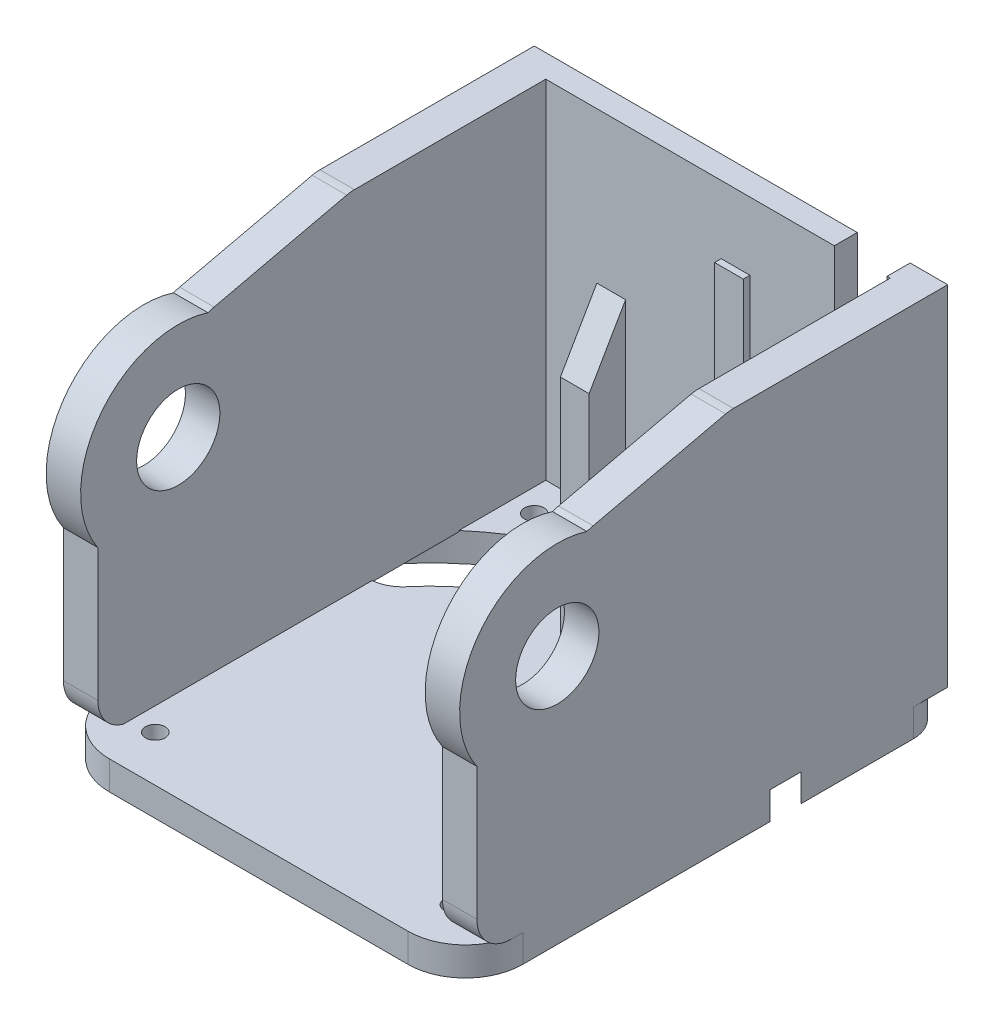
from build123d import *

# Parameters (mm, degrees)
BASE_START                                   = 59
BASE_PLATE_DEPTH                             = 5
BOLT_START                                   = 58.8
SKETCH2_R                                    = 1.7
BOLT_HOLES_CABLE_KIDNEY_DEPTH                = 5.4
CHEEK_START                                  = -36
CHEEK_X_DEPTH                                = 6
PIVOT_START                                  = -36
SKETCH4_R                                    = 17
PIVOT_BOSS_X_DEPTH                           = 6
CHEEK_START_2                                = 30
CHEEK_X_2_DEPTH                              = 6
PIVOT_START_2                                = 30
SKETCH6_R                                    = 17
PIVOT_BOSS_X_2_DEPTH                         = 6
JOURNAL_START                                = -37
SKETCH7_R                                    = 7.25
JOURNAL_BORES_DEPTH                          = 74
BACK_START                                   = -54
SKETCH8_W                                    = 72
SKETCH8_H                                    = 60.7
BACK_WALL_DEPTH                              = 4
PINION_START                                 = -55
SKETCH9_W                                    = 9.2
SKETCH9_H                                    = 45
PINION_NOTCH_DEPTH                           = 6
SERVO_START                                  = 0.55
SKETCH10_W                                   = 28.2
SKETCH10_H                                   = 58.7
SKETCH10_W_2                                 = 20.5
SKETCH10_H_2                                 = 41.5
SERVO_BULKHEAD_DEPTH                         = 5
TAB_START                                    = 0.35
SKETCH11_R                                   = 1.7
TAB_BOLT_HOLES_DEPTH                         = 5.4
TAB_START_2                                  = 2.85
TAB_NUT_POCKETS_DEPTH                        = 2.9
BULKHEAD_START                               = 0.35
BULKHEAD_CHAMFER_DEPTH                       = 5.4
HAND_START                                   = 0.35
SKETCH14_W                                   = 21.65
SKETCH14_H                                   = 13.8
HAND_FIX_BAR_OVER_THE_SERVO_WINDOW_SAW_DEPTH = 5.4


with BuildPart() as part:
    # Sketch1 → Base plate (new body)
    with BuildSketch(Plane(origin=(0, 0, 0), x_dir=(1, 0, 0), z_dir=(0, 1, 0)).offset(BASE_START)):
        with BuildLine():
            Line((-30, 54), (30, 54))
            ThreePointArc((30, 54), (34.242640687, 52.242640687), (36, 48))
            Line((36, 48), (36, -20))
            ThreePointArc((36, -20), (33.071067812, -27.071067812), (26, -30))
            Line((26, -30), (-26, -30))
            ThreePointArc((-26, -30), (-33.071067812, -27.071067812), (-36, -20))
            Line((-36, -20), (-36, 48))
            ThreePointArc((-36, 48), (-34.242640687, 52.242640687), (-30, 54))
        make_face()
    extrude(amount=BASE_PLATE_DEPTH)

    # Sketch2 → Bolt holes + cable kidney (cut)
    with BuildSketch(Plane(origin=(0, 0, 0), x_dir=(1, 0, 0), z_dir=(0, 1, 0)).offset(BOLT_START)):
        with Locations((-26, 44)):
            Circle(SKETCH2_R)
        with Locations((-26, -22)):
            Circle(SKETCH2_R)
        with Locations((26, 44)):
            Circle(SKETCH2_R)
        with Locations((26, -22)):
            Circle(SKETCH2_R)
        with BuildLine():
            ThreePointArc((-35.238044383, 29.568230046), (0, 46), (35.238044383, 29.568230046))
            ThreePointArc((35.238044383, 29.568230046), (34.498503383, 21.115237729), (26.045511066, 21.854778729))
            ThreePointArc((26.045511066, 21.854778729), (0, 34), (-26.045511066, 21.854778729))
            ThreePointArc((-26.045511066, 21.854778729), (-34.498503383, 21.115237729), (-35.238044383, 29.568230046))
        make_face()
    extrude(amount=BOLT_HOLES_CABLE_KIDNEY_DEPTH, mode=Mode.SUBTRACT)


with BuildPart() as bolt_holes_cable_kidney_piece_1:
    # of the separate pieces the step leaves, piece 1, a body of its own (bolt_holes_cable_kidney_pieces)
    add(part.part.solids().sort_by_distance((-36, 59, 20))[0])



with BuildPart() as bolt_holes_cable_kidney_piece_2:
    # of the separate pieces the step leaves, piece 2, a body of its own (bolt_holes_cable_kidney_pieces)
    add(part.part.solids().sort_by_distance((-30, 59, -54))[0])


with BuildPart() as bolt_holes_cable_kidney_piece_1_1:
    add(bolt_holes_cable_kidney_piece_1.part)

    add(bolt_holes_cable_kidney_piece_2.part)  # Cheek -X merges Bolt holes + cable kidney piece 2
    # Sketch3 → Cheek -X (add)
    with BuildSketch(Plane(origin=(0, 0, 0), x_dir=(0, 0, -1), z_dir=(1, 0, 0)).offset(CHEEK_START)):
        with BuildLine():
            Line((54, 63.8), (-22, 63.8))
            ThreePointArc((-22, 63.8), (-26.242640687, 65.557359313), (-28, 69.8))
            Line((-28, 69.8), (-28, 96.357864376))
            ThreePointArc((-28, 96.357864376), (-27.238795325, 100.1846987), (-25.071067812, 103.428932188))
            Line((-25.071067812, 103.428932188), (-11.622364452, 116.877635548))
            ThreePointArc((-11.622364452, 116.877635548), (-9.843658462, 118.217921148), (-7.764386256, 119.015910864))
            Line((-7.764386256, 119.015910864), (15.334171088, 124.346347174))
            ThreePointArc((15.334171088, 124.346347174), (16.004388899, 124.461463035), (16.683328128, 124.5))
            Line((16.683328128, 124.5), (54, 124.5))
            Line((54, 124.5), (54, 63.8))
        make_face()
    extrude(amount=CHEEK_X_DEPTH)

    # Sketch4 → Pivot boss -X (add)
    with BuildSketch(Plane(origin=(0, 0, 0), x_dir=(0, 0, -1), z_dir=(1, 0, 0)).offset(PIVOT_START)):
        with Locations((-14, 102.5)):
            Circle(SKETCH4_R)
    extrude(amount=PIVOT_BOSS_X_DEPTH)

    # Sketch5 → Cheek _X 2 (add)
    with BuildSketch(Plane(origin=(0, 0, 0), x_dir=(0, 0, -1), z_dir=(1, 0, 0)).offset(CHEEK_START_2)):
        with BuildLine():
            Line((54, 63.8), (-22, 63.8))
            ThreePointArc((-22, 63.8), (-26.242640687, 65.557359313), (-28, 69.8))
            Line((-28, 69.8), (-28, 96.357864376))
            ThreePointArc((-28, 96.357864376), (-27.238795325, 100.1846987), (-25.071067812, 103.428932188))
            Line((-25.071067812, 103.428932188), (-11.622364452, 116.877635548))
            ThreePointArc((-11.622364452, 116.877635548), (-9.843658462, 118.217921148), (-7.764386256, 119.015910864))
            Line((-7.764386256, 119.015910864), (15.334171088, 124.346347174))
            ThreePointArc((15.334171088, 124.346347174), (16.004388899, 124.461463035), (16.683328128, 124.5))
            Line((16.683328128, 124.5), (54, 124.5))
            Line((54, 124.5), (54, 63.8))
        make_face()
    extrude(amount=CHEEK_X_2_DEPTH)

    # Sketch6 → Pivot boss _X 2 (add)
    with BuildSketch(Plane(origin=(0, 0, 0), x_dir=(0, 0, -1), z_dir=(1, 0, 0)).offset(PIVOT_START_2)):
        with Locations((-14, 102.5)):
            Circle(SKETCH6_R)
    extrude(amount=PIVOT_BOSS_X_2_DEPTH)

    # Sketch7 → Journal bores (cut)
    with BuildSketch(Plane(origin=(0, 0, 0), x_dir=(0, 0, -1), z_dir=(1, 0, 0)).offset(JOURNAL_START)):
        with Locations((-14, 102.5)):
            Circle(SKETCH7_R)
    extrude(amount=JOURNAL_BORES_DEPTH, mode=Mode.SUBTRACT)

    # Sketch8 → Back wall (add)
    with BuildSketch(Plane.XY.offset(BACK_START)):
        with Locations((0, 94.15)):
            Rectangle(SKETCH8_W, SKETCH8_H)
    extrude(amount=BACK_WALL_DEPTH)

    # Sketch9 → Pinion notch (cut)
    with BuildSketch(Plane.XY.offset(PINION_START)):
        with Locations((24.85, 103)):
            Rectangle(SKETCH9_W, SKETCH9_H)
    extrude(amount=PINION_NOTCH_DEPTH, mode=Mode.SUBTRACT)

    # Sketch10 → Servo bulkhead (add)
    with BuildSketch(Plane(origin=(0, 0, 0), x_dir=(0, 0, -1), z_dir=(1, 0, 0)).offset(SERVO_START)):
        with Locations((36.1, 93.15)):
            Rectangle(SKETCH10_W, SKETCH10_H)
        with Locations((38.6, 92.15)):
            Rectangle(SKETCH10_W_2, SKETCH10_H_2, mode=Mode.SUBTRACT)
    extrude(amount=SERVO_BULKHEAD_DEPTH)

    # Sketch11 → Tab bolt holes (cut)
    with BuildSketch(Plane(origin=(0, 0, 0), x_dir=(0, 0, -1), z_dir=(1, 0, 0)).offset(TAB_START)):
        with Locations((33.6, 116.9)):
            Circle(SKETCH11_R)
        with Locations((43.6, 116.9)):
            Circle(SKETCH11_R)
        with Locations((33.6, 67.4)):
            Circle(SKETCH11_R)
        with Locations((43.6, 67.4)):
            Circle(SKETCH11_R)
    extrude(amount=TAB_BOLT_HOLES_DEPTH, mode=Mode.SUBTRACT)

    # Sketch12 → Tab nut pockets (cut)
    with BuildSketch(Plane(origin=(0, 0, 0), x_dir=(0, 0, -1), z_dir=(1, 0, 0)).offset(TAB_START_2)):
        Polygon((31.896816706, 119.85), (30.193633412, 116.9), (31.896816706, 113.95), (35.303183294, 113.95), (37.006366588, 116.9), (35.303183294, 119.85), align=None)
        Polygon((41.896816706, 119.85), (40.193633412, 116.9), (41.896816706, 113.95), (45.303183294, 113.95), (47.006366588, 116.9), (45.303183294, 119.85), align=None)
        Polygon((31.896816706, 70.35), (30.193633412, 67.4), (31.896816706, 64.45), (35.303183294, 64.45), (37.006366588, 67.4), (35.303183294, 70.35), align=None)
        Polygon((41.896816706, 70.35), (40.193633412, 67.4), (41.896816706, 64.45), (45.303183294, 64.45), (47.006366588, 67.4), (45.303183294, 70.35), align=None)
    extrude(amount=TAB_NUT_POCKETS_DEPTH, mode=Mode.SUBTRACT)

    # Sketch13 → Bulkhead chamfer (cut)
    with BuildSketch(Plane(origin=(0, 0, 0), x_dir=(0, 0, -1), z_dir=(1, 0, 0)).offset(BULKHEAD_START)):
        Polygon((21.8, 108.5), (21.8, 122.7), (30, 122.7), align=None)
    extrude(amount=BULKHEAD_CHAMFER_DEPTH, mode=Mode.SUBTRACT)

    # Sketch14 → HAND FIX - bar over the servo window sawn out (cut)
    with BuildSketch(Plane(origin=(0, 0, 0), x_dir=(0, 0, -1), z_dir=(1, 0, 0)).offset(HAND_START)):
        with Locations((39.175, 119.6)):
            Rectangle(SKETCH14_W, SKETCH14_H)
    extrude(amount=HAND_FIX_BAR_OVER_THE_SERVO_WINDOW_SAW_DEPTH, mode=Mode.SUBTRACT)


solid = bolt_holes_cable_kidney_piece_1_1.part
